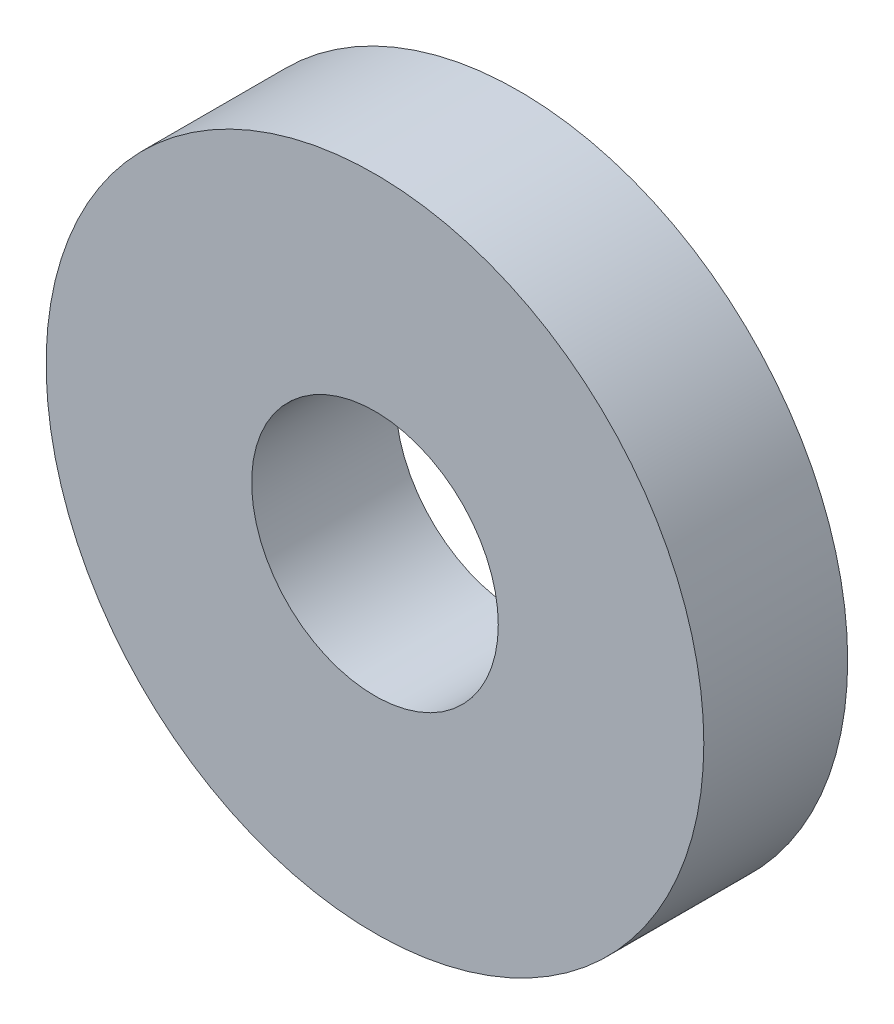
from build123d import *

# Parameters (mm, degrees)
SKETCH1_W = 10
SKETCH1_H = 7


with BuildPart() as part:
    # Sketch1 → REV_Radial_Seal_12x32x7_envelope (revolve)
    with BuildSketch(Plane(origin=(0, 0, 0), x_dir=(1, 0, 0), z_dir=(0, 1, 0))):
        with Locations((11, -50.5)):
            Rectangle(SKETCH1_W, SKETCH1_H)
    revolve(axis=Axis((0, 0, 150), (0, 0, -1)))


solid = part.part
